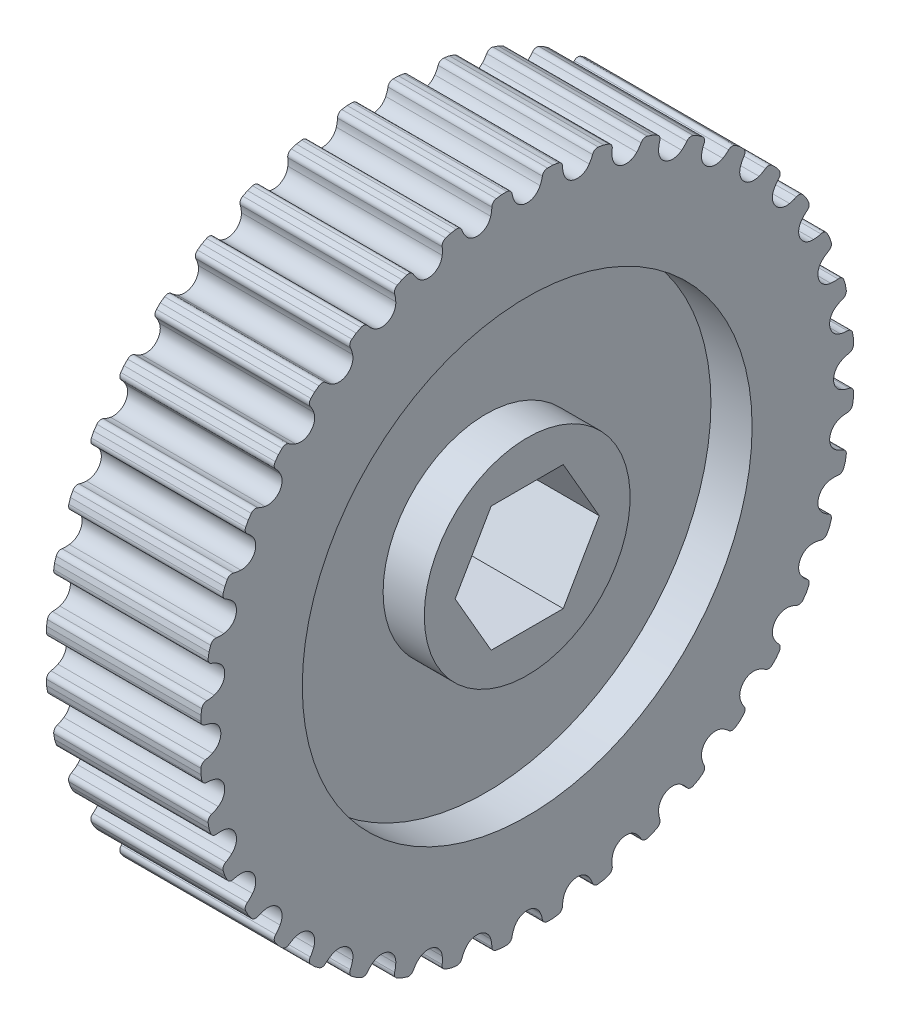
from build123d import *

# Parameters (mm, degrees)
CUT_EXTRUDE1_DEPTH = 20
CUT_EXTRUDE2_DEPTH = 56.8520705
CIRPATTERN1_COUNT  = 40


with BuildPart() as part:
    # Sketch1 → Revolve1 (revolve)
    with BuildSketch(Plane.XY, mode=Mode.PRIVATE) as revolve1_sk:
        Polygon((-74.749419838, -11.509327546), (-74.749419814, -1.509327546), (-78.749419814, -1.509327536), (-78.749419785, 10.340672454), (-74.749419785, 10.340672454), (-74.749419785, 20.340672454), (-89.749419785, 20.340672471), (-89.749419785, 10.340672471), (-85.749419785, 10.340672471), (-85.749419814, -1.509327519), (-89.749419814, -1.50932751), (-89.749419838, -11.50932751), align=None)
    revolve(revolve1_sk.sketch.rotate(Axis((-151.292726408, -11.50932751, 0), (1, 0, 0)), 90), axis=Axis((-151.292726408, -11.50932751, 0), (1, 0, 0)))

    # Sketch2 → Cut-Extrude1 (cut)
    with BuildSketch(Plane.ZY.offset(89.749419826)):
        Polygon((7, -11.57624172), (3.5, -5.514063894), (-3.5, -5.514063894), (-7, -11.57624172), (-3.5, -17.638419547), (3.5, -17.638419547), align=None)
    extrude(amount=-CUT_EXTRUDE1_DEPTH, mode=Mode.SUBTRACT)

    # Sketch3 → Cut-Extrude2 (cut, through all)
    with BuildSketch(Plane.ZY.offset(89.749419785)):
        with BuildLine():
            Line((-1.977058363, 20.185853298), (-2.5, 20.185853298))
            Line((-2.5, 20.185853298), (-2.5, 22.055853298))
            Line((-2.5, 22.055853298), (2.5, 22.055853298))
            Line((2.5, 22.055853298), (2.5, 20.185853298))
            Line((2.5, 20.185853298), (1.977058363, 20.185853298))
            ThreePointArc((1.977058363, 20.185853298), (1.647962732, 20.065463444), (1.474238768, 19.761131987))
            ThreePointArc((1.474238768, 19.761131987), (1.389274836, 19.412090242), (1.255919029, 19.078525798))
            ThreePointArc((1.255919029, 19.078525798), (0, 18.255853298), (-1.255919029, 19.078525798))
            ThreePointArc((-1.255919029, 19.078525798), (-1.389274836, 19.412090242), (-1.474238768, 19.761131987))
            ThreePointArc((-1.474238768, 19.761131987), (-1.647962732, 20.065463444), (-1.977058363, 20.185853298))
        make_face()
    cut_extrude2 = extrude(amount=-CUT_EXTRUDE2_DEPTH, mode=Mode.SUBTRACT)

    # CirPattern1: Cut-Extrude2 ×40 about axis
    cirpattern1_axis = Axis((0, -11.50932751, 0), (1, 0, 0))
    for i in range(1, CIRPATTERN1_COUNT):
        add(cut_extrude2.rotate(cirpattern1_axis, i * 360 / CIRPATTERN1_COUNT), mode=Mode.SUBTRACT)


solid = part.part
